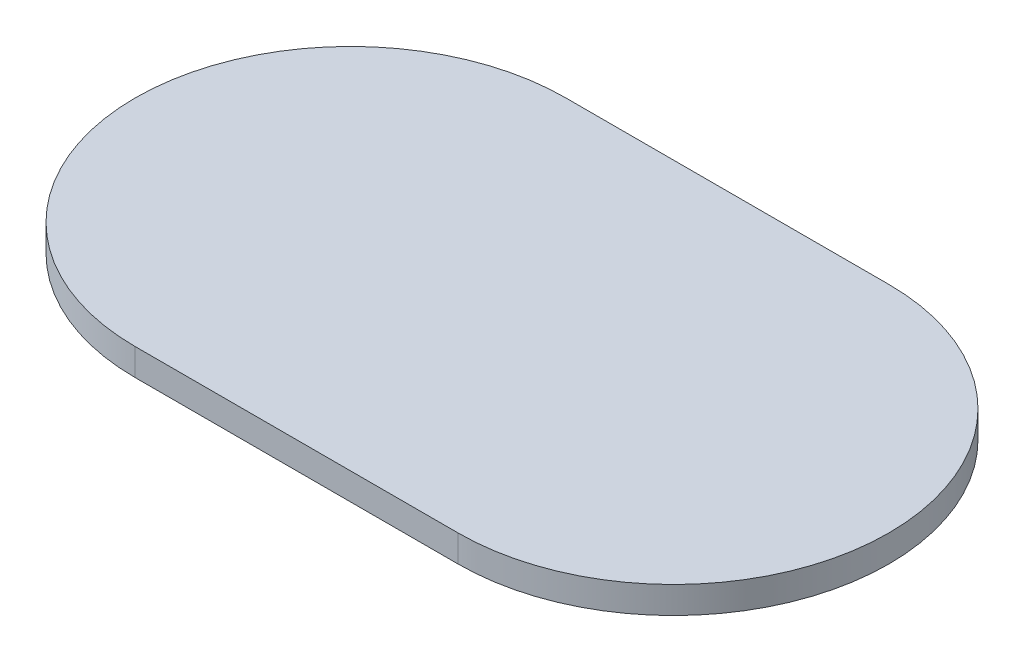
from build123d import *

# Parameters (mm, degrees)
BOSS_EXTRUDE1_DEPTH = 5


with BuildPart() as part:
    # Sketch1 → Boss-Extrude1 (new body)
    with BuildSketch(Plane(origin=(0, 0, 0), x_dir=(1, 0, 0), z_dir=(0, 1, 0))):
        with BuildLine():
            Line((30, 0), (-30, 0))
            ThreePointArc((-30, 0), (-70, 40), (-30, 80))
            Line((-30, 80), (30, 80))
            ThreePointArc((30, 80), (70, 40), (30, 0))
        make_face()
    extrude(amount=BOSS_EXTRUDE1_DEPTH)


solid = part.part
